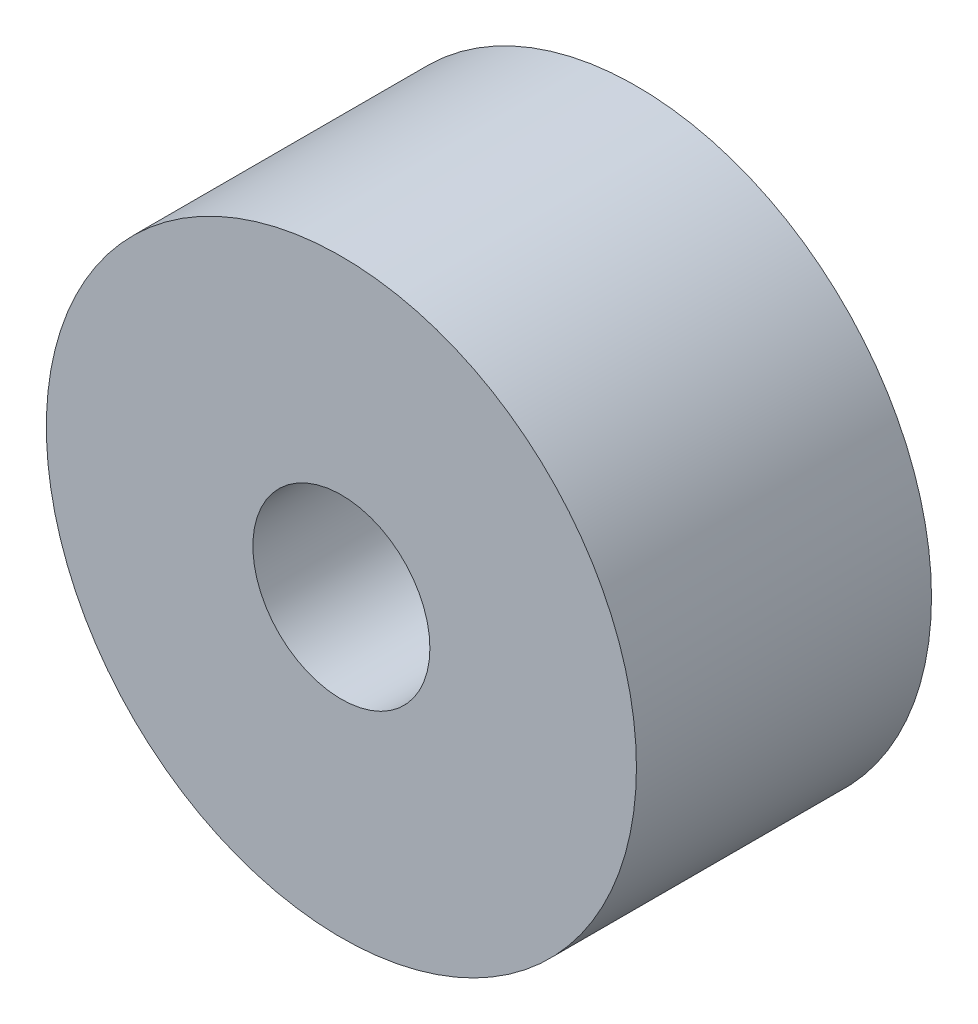
from build123d import *

# Parameters (mm, degrees)
ESQUISSE1_R        = 10
ESQUISSE1_R_2      = 3
BOSS_EXTRU_1_DEPTH = 10


with BuildPart() as part:
    # Esquisse1 → Boss.-Extru.1 (new body)
    with BuildSketch(Plane.XY):
        Circle(ESQUISSE1_R)
        Circle(ESQUISSE1_R_2, mode=Mode.SUBTRACT)
    extrude(amount=BOSS_EXTRU_1_DEPTH)


solid = part.part
